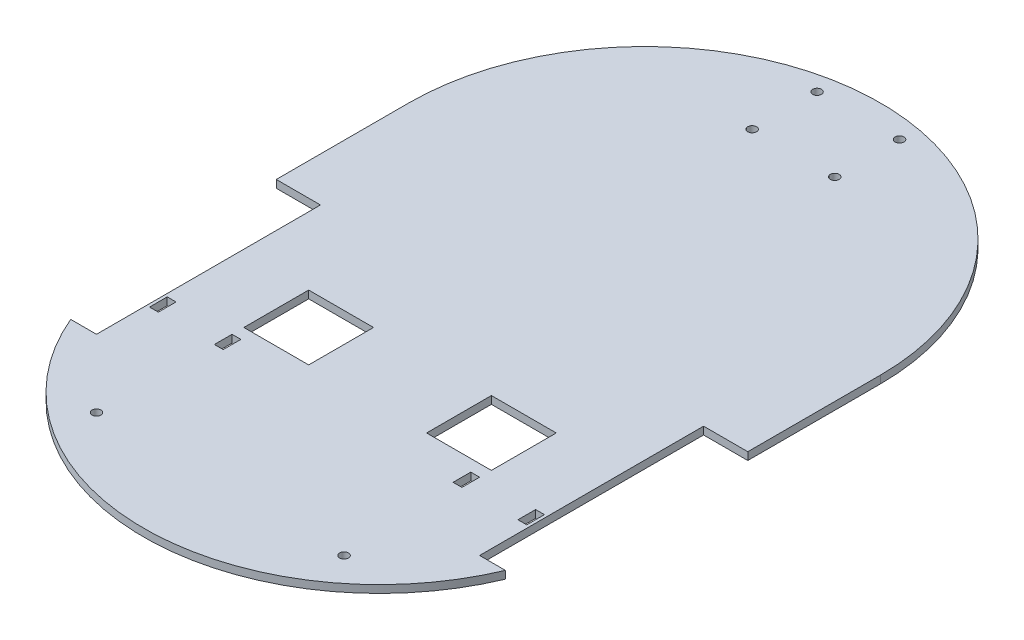
from build123d import *

# Parameters (mm, degrees)
SKETCH2_R           = 1.5
SKETCH2_W           = 3
SKETCH2_H           = 6
SKETCH2_W_2         = 22
SKETCH2_H_2         = 22
BOSS_EXTRUDE2_DEPTH = 2.6


with BuildPart() as part:
    # Sketch2 → Boss-Extrude2 (new body)
    with BuildSketch(Plane(origin=(0, 0, 0), x_dir=(1, 0, 0), z_dir=(0, 1, 0))):
        with BuildLine():
            Line((-80, 45), (-80, 0))
            Line((-80, 0), (-65, 0))
            Line((-65, 0), (-65, -76))
            Line((-65, -76), (-73.74957627, -76))
            ThreePointArc((-73.74957627, -76), (0, -125), (73.74957627, -76))
            Line((73.74957627, -76), (65, -76))
            Line((65, -76), (65, 0))
            Line((65, 0), (80, 0))
            Line((80, 0), (80, 45))
            ThreePointArc((80, 45), (0, 125), (-80, 45))
        make_face()
        with Locations(Location((-42, -99, 0), (0, 0, 270))):
            Circle(SKETCH2_R, mode=Mode.SUBTRACT)
        with Locations((-62.5, -56)):
            Rectangle(SKETCH2_W, SKETCH2_H, mode=Mode.SUBTRACT)
        with Locations((-40.5, -56)):
            Rectangle(SKETCH2_W, SKETCH2_H, mode=Mode.SUBTRACT)
        with Locations((-31, -38)):
            Rectangle(SKETCH2_W_2, SKETCH2_H_2, mode=Mode.SUBTRACT)
        with Locations(Location((42, -99, 0), (0, 0, 270))):
            Circle(SKETCH2_R, mode=Mode.SUBTRACT)
        with Locations((40.5, -56)):
            Rectangle(SKETCH2_W, SKETCH2_H, mode=Mode.SUBTRACT)
        with Locations((31, -38)):
            Rectangle(SKETCH2_W_2, SKETCH2_H_2, mode=Mode.SUBTRACT)
        with Locations((62.5, -56)):
            Rectangle(SKETCH2_W, SKETCH2_H, mode=Mode.SUBTRACT)
        with Locations(Location((-14, 95.5, 0), (0, 0, 270))):
            Circle(SKETCH2_R, mode=Mode.SUBTRACT)
        with Locations(Location((-14, 117.5, 0), (0, 0, 270))):
            Circle(SKETCH2_R, mode=Mode.SUBTRACT)
        with Locations(Location((14, 95.5, 0), (0, 0, 270))):
            Circle(SKETCH2_R, mode=Mode.SUBTRACT)
        with Locations(Location((14, 117.5, 0), (0, 0, 270))):
            Circle(SKETCH2_R, mode=Mode.SUBTRACT)
    extrude(amount=BOSS_EXTRUDE2_DEPTH)


solid = part.part
